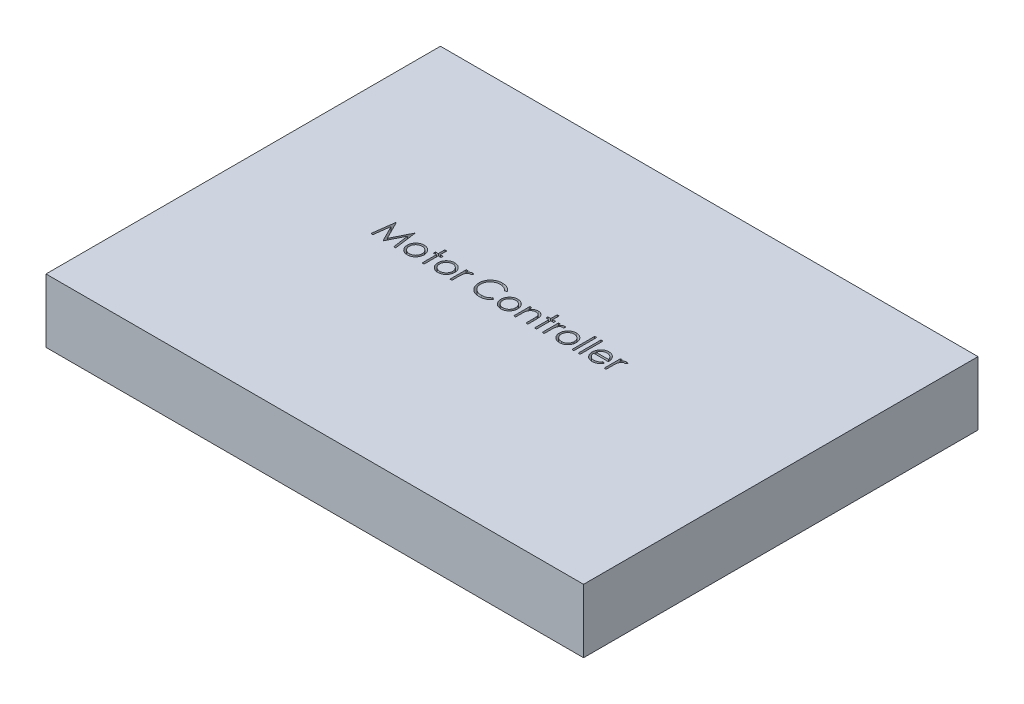
from build123d import *

# Parameters (mm, degrees)
SKETCH1_W           = 84.5
SKETCH1_H           = 62
BOSS_EXTRUDE1_DEPTH = 10
SKETCH2_W           = 0.314102564
SKETCH2_H           = 3.589743589
SKETCH2_W_2         = 0.314102565
CUT_EXTRUDE1_DEPTH  = 2.032


with BuildPart() as part:
    # Sketch1 → Boss-Extrude1 (new body)
    with BuildSketch(Plane(origin=(0, 0, 0), x_dir=(1, 0, 0), z_dir=(0, 1, 0))):
        Rectangle(SKETCH1_W, SKETCH1_H)
    extrude(amount=BOSS_EXTRUDE1_DEPTH)

    # Sketch2 → Cut-Extrude1 (cut)
    # profile 1 of 15: a face of its own
    with BuildSketch(Plane(origin=(0, 10, 0), x_dir=(1, 0, 0), z_dir=(0, 1, 0))):
        Polygon((-22.223237795, 0.043930603), (-21.761198533, 3.543930603), (-21.716326738, 3.543930603), (-20.271314719, 0.672135731), (-18.829808308, 3.543930603), (-18.784235392, 3.543930603), (-18.319391642, 0.043930603), (-18.634896449, 0.043930603), (-18.970032667, 2.56236009), (-20.233454142, 0.043930603), (-20.304267443, 0.043930603), (-21.57259677, 2.567969064), (-21.907031866, 0.043930603), align=None)
    # profile 2 of 15: a face of its own
    with BuildSketch(Plane(origin=(0, 10, 0), x_dir=(1, 0, 0), z_dir=(0, 1, 0))):
        with BuildLine():
            add(Edge.make_bspline(
                [(-16.455809911, 2.646494705), (-16.407818638, 2.645472814), (-16.31371948, 2.643469135), (-16.175911595, 2.62205417), (-16.044366459, 2.589306805), (-15.918580266, 2.544035243), (-15.800163971, 2.483353293), (-15.687392727, 2.410944002), (-15.580575718, 2.325161408), (-15.516552689, 2.25880334), (-15.484055103, 2.225120507)],
                knots=[0, 0, 0, 0, 1.054011418, 2.066658804, 3.057071809, 4.030435133, 4.997543892, 5.974964718, 6.972108034, 8, 8, 8, 8], degree=3))
            add(Edge.make_bspline(
                [(-15.484055103, 2.225120507), (-15.456073149, 2.192906521), (-15.400650769, 2.129101979), (-15.32958505, 2.025646366), (-15.26836349, 1.918506265), (-15.219300529, 1.806258938), (-15.180615505, 1.689884267), (-15.153149809, 1.568982256), (-15.136812874, 1.443819909), (-15.134609907, 1.358816071), (-15.133494206, 1.315765539)],
                knots=[0, 0, 0, 0, 1.025258237, 2.030674902, 3.01204498, 3.988269485, 4.97094183, 5.956517959, 6.965070386, 8, 8, 8, 8], degree=3))
            add(Edge.make_bspline(
                [(-15.133494206, 1.315765539), (-15.134475543, 1.272465481), (-15.136414711, 1.186902548), (-15.154758328, 1.060883182), (-15.183289414, 0.938688359), (-15.224121252, 0.820829665), (-15.276479361, 0.706946838), (-15.340370049, 0.597537289), (-15.416241666, 0.492385155), (-15.502245663, 0.392383317), (-15.597297539, 0.300217102), (-15.700413687, 0.219888833), (-15.809567721, 0.151067308), (-15.926211074, 0.095630893), (-16.049278561, 0.051921192), (-16.179035629, 0.021221176), (-16.315280699, 0.002659492), (-16.408307921, 0.000275919), (-16.455809911, -0.000941192)],
                knots=[0, 0, 0, 0, 0.998656419, 1.973391657, 2.932242238, 3.890759089, 4.846373663, 5.82037756, 6.809684879, 7.83454468, 8.860553229, 9.859544525, 10.845671541, 11.83227036, 12.833544569, 13.85385346, 14.904124723, 16, 16, 16, 16], degree=3))
            add(Edge.make_bspline(
                [(-16.455809911, -0.000941192), (-16.50354463, 0.000280004), (-16.59703549, 0.002671778), (-16.733761472, 0.021149061), (-16.863751091, 0.051907044), (-16.986979689, 0.095774537), (-17.104124536, 0.15106908), (-17.213911033, 0.21968077), (-17.317110949, 0.300240925), (-17.412182933, 0.392376862), (-17.498181539, 0.492386818), (-17.574054547, 0.597536857), (-17.637944873, 0.70694695), (-17.690303077, 0.820829635), (-17.73113489, 0.938688367), (-17.759665983, 1.06088318), (-17.778009597, 1.186902548), (-17.779948766, 1.272465481), (-17.780930103, 1.315765539)],
                knots=[0, 0, 0, 0, 1.099876186, 2.154163076, 3.173186993, 4.173200201, 5.163417411, 6.152872554, 7.150605724, 8.17532212, 9.198891216, 10.186952605, 11.159729845, 12.11414092, 13.071450619, 14.029093627, 15.002601286, 16, 16, 16, 16], degree=3))
            add(Edge.make_bspline(
                [(-17.780930103, 1.315765539), (-17.779806793, 1.358582084), (-17.777582831, 1.443351487), (-17.761262322, 1.568278548), (-17.733903766, 1.688975937), (-17.695172369, 1.804901413), (-17.645657178, 1.916656849), (-17.585295891, 2.02406168), (-17.513505258, 2.12704948), (-17.458303306, 2.19077156), (-17.430369206, 2.223017141)],
                knots=[0, 0, 0, 0, 1.031353054, 2.041901799, 3.029428768, 4.008703097, 4.981709435, 5.96992636, 6.972712378, 8, 8, 8, 8], degree=3))
            add(Edge.make_bspline(
                [(-17.430369206, 2.223017141), (-17.397920615, 2.25699208), (-17.334104751, 2.323809777), (-17.226756023, 2.409342301), (-17.114262202, 2.483258375), (-16.994537276, 2.54273459), (-16.868854418, 2.589573108), (-16.736635175, 2.622138623), (-16.59835966, 2.643391978), (-16.503800039, 2.645450156), (-16.455809911, 2.646494705)],
                knots=[0, 0, 0, 0, 1.027980169, 2.021703884, 2.998553061, 3.971491411, 4.943284454, 5.930300938, 6.949603206, 8, 8, 8, 8], degree=3))
        make_face()
        with BuildLine():
            add(Edge.make_bspline(
                [(-16.457212154, 2.332392141), (-16.491149766, 2.331427549), (-16.558148894, 2.329523267), (-16.656768479, 2.315039362), (-16.751708633, 2.292091858), (-16.843149477, 2.259487802), (-16.93078265, 2.217388903), (-17.014692052, 2.165680543), (-17.095124492, 2.105047586), (-17.170506555, 2.035584915), (-17.239688867, 1.95970592), (-17.300166844, 1.878857561), (-17.35159195, 1.794351215), (-17.394432109, 1.706099004), (-17.426339297, 1.61320659), (-17.44951232, 1.516725959), (-17.46398256, 1.416460542), (-17.465868939, 1.348299524), (-17.466827539, 1.313662173)],
                knots=[0, 0, 0, 0, 1.021534396, 2.016698045, 2.994645724, 3.958388632, 4.93408049, 5.916473867, 6.921342795, 7.962252576, 8.998418191, 10.008913653, 10.997312074, 11.973003931, 12.956656626, 13.948281152, 14.957379055, 16, 16, 16, 16], degree=3))
            add(Edge.make_bspline(
                [(-17.466827539, 1.313662173), (-17.465220715, 1.268910146), (-17.462031471, 1.180085741), (-17.436096235, 1.049274618), (-17.392709955, 0.923692766), (-17.334122675, 0.80407638), (-17.260716456, 0.693404102), (-17.17422939, 0.594732617), (-17.075589689, 0.509546806), (-16.965973189, 0.43886596), (-16.847618871, 0.382706205), (-16.72236255, 0.342907229), (-16.591721856, 0.317035536), (-16.502441125, 0.314464062), (-16.457212154, 0.313161372)],
                knots=[0, 0, 0, 0, 1.016792936, 2.018143844, 3.017858371, 4.030088057, 5.03801393, 6.028138512, 7.003788237, 7.991172063, 8.984598303, 9.972568034, 10.972917682, 12, 12, 12, 12], degree=3))
            add(Edge.make_bspline(
                [(-16.457212154, 0.313161372), (-16.411985786, 0.314471652), (-16.32271019, 0.317058109), (-16.192251013, 0.342776929), (-16.067337041, 0.382880589), (-15.949105653, 0.438802799), (-15.83953905, 0.509815214), (-15.740189929, 0.594251591), (-15.654441317, 0.693665443), (-15.581107713, 0.804222971), (-15.52156097, 0.923507323), (-15.478377768, 1.049297796), (-15.452380182, 1.180079838), (-15.449199353, 1.268908168), (-15.44759677, 1.313662173)],
                knots=[0, 0, 0, 0, 1.02726834, 2.027799167, 3.010890988, 4.004497153, 4.992059811, 5.971914811, 6.958719428, 7.966827853, 8.981595046, 9.981490638, 10.983022906, 12, 12, 12, 12], degree=3))
            add(Edge.make_bspline(
                [(-15.44759677, 1.313662173), (-15.44855504, 1.348299731), (-15.450440769, 1.416461157), (-15.464915733, 1.51672361), (-15.488071273, 1.613215207), (-15.52004289, 1.70606721), (-15.562696904, 1.794579714), (-15.615113697, 1.878609441), (-15.675344723, 1.959985987), (-15.745361843, 2.035339628), (-15.820665221, 2.105074665), (-15.90113026, 2.165704054), (-15.984915238, 2.21716165), (-16.072293821, 2.25984789), (-16.163746388, 2.291795231), (-16.258553518, 2.315171862), (-16.356752328, 2.329462059), (-16.423511371, 2.3314092), (-16.457212154, 2.332392141)],
                knots=[0, 0, 0, 0, 1.042956736, 2.052379634, 3.044323526, 4.02829302, 5.004299113, 5.996692471, 7.007513377, 8.048758398, 9.090003419, 10.095195979, 11.07790575, 12.047570684, 13.018257071, 13.989683339, 14.985167495, 16, 16, 16, 16], degree=3))
        make_face(mode=Mode.SUBTRACT)
    # profile 3 of 15: a face of its own
    with BuildSketch(Plane(origin=(0, 10, 0), x_dir=(1, 0, 0), z_dir=(0, 1, 0))):
        Polygon((-14.191186513, 3.633674192), (-13.877083949, 3.633674192), (-13.877083949, 2.60162291), (-13.428366001, 2.60162291), (-13.428366001, 2.287520346), (-13.877083949, 2.287520346), (-13.877083949, 0.043930603), (-14.191186513, 0.043930603), (-14.191186513, 2.287520346), (-14.639904462, 2.287520346), (-14.639904462, 2.60162291), (-14.191186513, 2.60162291), align=None)
    # profile 4 of 15: a face of its own
    with BuildSketch(Plane(origin=(0, 10, 0), x_dir=(1, 0, 0), z_dir=(0, 1, 0))):
        with BuildLine():
            add(Edge.make_bspline(
                [(-11.65452786, 2.646494705), (-11.606536587, 2.645472814), (-11.512437429, 2.643469135), (-11.374629543, 2.62205417), (-11.243084407, 2.589306805), (-11.117298215, 2.544035243), (-10.99888192, 2.483353293), (-10.886110676, 2.410944002), (-10.779293667, 2.325161408), (-10.715270637, 2.25880334), (-10.682773052, 2.225120507)],
                knots=[0, 0, 0, 0, 1.054011418, 2.066658804, 3.057071809, 4.030435133, 4.997543892, 5.974964718, 6.972108034, 8, 8, 8, 8], degree=3))
            add(Edge.make_bspline(
                [(-10.682773052, 2.225120507), (-10.654791098, 2.192906521), (-10.599368718, 2.129101979), (-10.528302999, 2.025646366), (-10.467081439, 1.918506265), (-10.418018478, 1.806258938), (-10.379333454, 1.689884267), (-10.351867758, 1.568982256), (-10.335530823, 1.443819909), (-10.333327856, 1.358816071), (-10.332212154, 1.315765539)],
                knots=[0, 0, 0, 0, 1.025258237, 2.030674902, 3.01204498, 3.988269485, 4.97094183, 5.956517959, 6.965070386, 8, 8, 8, 8], degree=3))
            add(Edge.make_bspline(
                [(-10.332212154, 1.315765539), (-10.333193492, 1.272465481), (-10.33513266, 1.186902548), (-10.353476276, 1.060883182), (-10.382007362, 0.938688359), (-10.422839201, 0.820829665), (-10.47519731, 0.706946838), (-10.539087997, 0.597537289), (-10.614959614, 0.492385155), (-10.700963611, 0.392383317), (-10.796015487, 0.300217102), (-10.899131636, 0.219888833), (-11.008285669, 0.151067308), (-11.124929023, 0.095630893), (-11.24799651, 0.051921192), (-11.377753578, 0.021221176), (-11.513998648, 0.002659492), (-11.607025869, 0.000275919), (-11.65452786, -0.000941192)],
                knots=[0, 0, 0, 0, 0.998656419, 1.973391657, 2.932242238, 3.890759089, 4.846373663, 5.82037756, 6.809684879, 7.83454468, 8.860553229, 9.859544525, 10.845671541, 11.83227036, 12.833544569, 13.85385346, 14.904124723, 16, 16, 16, 16], degree=3))
            add(Edge.make_bspline(
                [(-11.65452786, -0.000941192), (-11.702262579, 0.000280004), (-11.795753439, 0.002671778), (-11.932479421, 0.021149061), (-12.06246904, 0.051907044), (-12.185697638, 0.095774537), (-12.302842485, 0.15106908), (-12.412628982, 0.21968077), (-12.515828898, 0.300240925), (-12.610900882, 0.392376862), (-12.696899487, 0.492386818), (-12.772772496, 0.597536857), (-12.836662822, 0.70694695), (-12.889021026, 0.820829635), (-12.929852839, 0.938688367), (-12.958383931, 1.06088318), (-12.976727546, 1.186902548), (-12.978666714, 1.272465481), (-12.979648052, 1.315765539)],
                knots=[0, 0, 0, 0, 1.099876186, 2.154163076, 3.173186993, 4.173200201, 5.163417411, 6.152872554, 7.150605724, 8.17532212, 9.198891216, 10.186952605, 11.159729845, 12.11414092, 13.071450619, 14.029093627, 15.002601286, 16, 16, 16, 16], degree=3))
            add(Edge.make_bspline(
                [(-12.979648052, 1.315765539), (-12.978524742, 1.358582084), (-12.97630078, 1.443351487), (-12.959980271, 1.568278548), (-12.932621715, 1.688975937), (-12.893890318, 1.804901413), (-12.844375127, 1.916656849), (-12.784013839, 2.02406168), (-12.712223207, 2.12704948), (-12.657021255, 2.19077156), (-12.629087154, 2.223017141)],
                knots=[0, 0, 0, 0, 1.031353054, 2.041901799, 3.029428768, 4.008703097, 4.981709435, 5.96992636, 6.972712378, 8, 8, 8, 8], degree=3))
            add(Edge.make_bspline(
                [(-12.629087154, 2.223017141), (-12.596638563, 2.25699208), (-12.5328227, 2.323809777), (-12.425473972, 2.409342301), (-12.312980151, 2.483258375), (-12.193255225, 2.54273459), (-12.067572367, 2.589573108), (-11.935353124, 2.622138623), (-11.797077609, 2.643391978), (-11.702517988, 2.645450156), (-11.65452786, 2.646494705)],
                knots=[0, 0, 0, 0, 1.027980169, 2.021703884, 2.998553061, 3.971491411, 4.943284454, 5.930300938, 6.949603206, 8, 8, 8, 8], degree=3))
        make_face()
        with BuildLine():
            add(Edge.make_bspline(
                [(-11.655930103, 2.332392141), (-11.689867714, 2.331427549), (-11.756866843, 2.329523267), (-11.855486428, 2.315039362), (-11.950426582, 2.292091858), (-12.041867426, 2.259487802), (-12.129500598, 2.217388903), (-12.213410001, 2.165680543), (-12.293842441, 2.105047586), (-12.369224504, 2.035584915), (-12.438406816, 1.95970592), (-12.498884793, 1.878857561), (-12.550309899, 1.794351215), (-12.593150058, 1.706099004), (-12.625057246, 1.61320659), (-12.648230269, 1.516725959), (-12.662700509, 1.416460542), (-12.664586888, 1.348299524), (-12.665545488, 1.313662173)],
                knots=[0, 0, 0, 0, 1.021534396, 2.016698045, 2.994645724, 3.958388632, 4.93408049, 5.916473867, 6.921342795, 7.962252576, 8.998418191, 10.008913653, 10.997312074, 11.973003931, 12.956656626, 13.948281152, 14.957379055, 16, 16, 16, 16], degree=3))
            add(Edge.make_bspline(
                [(-12.665545488, 1.313662173), (-12.663938664, 1.268910146), (-12.66074942, 1.180085741), (-12.634814183, 1.049274618), (-12.591427903, 0.923692766), (-12.532840624, 0.80407638), (-12.459434405, 0.693404102), (-12.372947338, 0.594732617), (-12.274307638, 0.509546806), (-12.164691138, 0.43886596), (-12.04633682, 0.382706205), (-11.921080499, 0.342907229), (-11.790439805, 0.317035536), (-11.701159074, 0.314464062), (-11.655930103, 0.313161372)],
                knots=[0, 0, 0, 0, 1.016792936, 2.018143844, 3.017858371, 4.030088057, 5.03801393, 6.028138512, 7.003788237, 7.991172063, 8.984598303, 9.972568034, 10.972917682, 12, 12, 12, 12], degree=3))
            add(Edge.make_bspline(
                [(-11.655930103, 0.313161372), (-11.610703734, 0.314471652), (-11.521428138, 0.317058109), (-11.390968961, 0.342776929), (-11.26605499, 0.382880589), (-11.147823602, 0.438802799), (-11.038256999, 0.509815214), (-10.938907877, 0.594251591), (-10.853159266, 0.693665443), (-10.779825661, 0.804222971), (-10.720278919, 0.923507323), (-10.677095717, 1.049297796), (-10.651098131, 1.180079838), (-10.647917302, 1.268908168), (-10.646314719, 1.313662173)],
                knots=[0, 0, 0, 0, 1.02726834, 2.027799167, 3.010890988, 4.004497153, 4.992059811, 5.971914811, 6.958719428, 7.966827853, 8.981595046, 9.981490638, 10.983022906, 12, 12, 12, 12], degree=3))
            add(Edge.make_bspline(
                [(-10.646314719, 1.313662173), (-10.647272989, 1.348299731), (-10.649158718, 1.416461157), (-10.663633682, 1.51672361), (-10.686789222, 1.613215207), (-10.718760839, 1.70606721), (-10.761414853, 1.794579714), (-10.813831646, 1.878609441), (-10.874062671, 1.959985987), (-10.944079792, 2.035339628), (-11.01938317, 2.105074665), (-11.099848208, 2.165704054), (-11.183633187, 2.21716165), (-11.27101177, 2.25984789), (-11.362464337, 2.291795231), (-11.457271466, 2.315171862), (-11.555470276, 2.329462059), (-11.622229319, 2.3314092), (-11.655930103, 2.332392141)],
                knots=[0, 0, 0, 0, 1.042956736, 2.052379634, 3.044323526, 4.02829302, 5.004299113, 5.996692471, 7.007513377, 8.048758398, 9.090003419, 10.095195979, 11.07790575, 12.047570684, 13.018257071, 13.989683339, 14.985167495, 16, 16, 16, 16], degree=3))
        make_face(mode=Mode.SUBTRACT)
    # profile 5 of 15: a face of its own
    with BuildSketch(Plane(origin=(0, 10, 0), x_dir=(1, 0, 0), z_dir=(0, 1, 0))):
        with BuildLine():
            Line((-9.793750616, 2.60162291), (-9.479648052, 2.60162291))
            Line((-9.479648052, 2.60162291), (-9.479648052, 2.225120507))
            add(Edge.make_bspline(
                [(-9.479648052, 2.225120507), (-9.456459293, 2.260176335), (-9.412110972, 2.327220334), (-9.338398043, 2.415889635), (-9.262894712, 2.489304682), (-9.185239524, 2.547808201), (-9.104861424, 2.591621319), (-9.023524473, 2.623714354), (-8.939949003, 2.64269167), (-8.883787079, 2.645225329), (-8.855649654, 2.646494705)],
                knots=[0, 0, 0, 0, 1.2804753, 2.448899062, 3.506932113, 4.484331642, 5.4025378, 6.288909075, 7.142734305, 8, 8, 8, 8], degree=3))
            add(Edge.make_bspline(
                [(-8.855649654, 2.646494705), (-8.833823328, 2.645304179), (-8.788914243, 2.642854593), (-8.720931653, 2.625643768), (-8.650888201, 2.598165746), (-8.605745814, 2.572325523), (-8.582212154, 2.558854481)],
                knots=[0, 0, 0, 0, 0.901110191, 1.854092781, 2.881294221, 4, 4, 4, 4], degree=3))
            Line((-8.582212154, 2.558854481), (-8.754688116, 2.286819224))
            add(Edge.make_bspline(
                [(-8.754688116, 2.286819224), (-8.769797137, 2.293559491), (-8.798476952, 2.306353806), (-8.840431518, 2.321495816), (-8.879112855, 2.330411732), (-8.903756413, 2.331762449), (-8.915245007, 2.332392141)],
                knots=[0, 0, 0, 0, 1.180555205, 2.24091978, 3.179933427, 4, 4, 4, 4], degree=3))
            add(Edge.make_bspline(
                [(-8.915245007, 2.332392141), (-8.940450741, 2.330712104), (-8.99186313, 2.327285315), (-9.06734763, 2.300346507), (-9.140594835, 2.256821267), (-9.198766498, 2.208550155), (-9.243808751, 2.162002357), (-9.275948976, 2.121353955), (-9.305431723, 2.075775323), (-9.333601943, 2.026045639), (-9.359268238, 1.971315793), (-9.383222907, 1.91213258), (-9.40488177, 1.848427451), (-9.417232014, 1.804044931), (-9.423558308, 1.78131041)],
                knots=[0, 0, 0, 0, 1.125678352, 2.296057538, 3.5422874, 4.923748041, 5.663163013, 6.437101912, 7.23742474, 8.08941207, 8.991984279, 9.93940061, 10.944477711, 12, 12, 12, 12], degree=3))
            add(Edge.make_bspline(
                [(-9.423558308, 1.78131041), (-9.428290702, 1.761033237), (-9.438772593, 1.716120838), (-9.448964131, 1.640772313), (-9.459033649, 1.551748655), (-9.466130268, 1.448802062), (-9.47270831, 1.332189618), (-9.476418392, 1.201733672), (-9.479521532, 1.057300321), (-9.479604599, 0.956325968), (-9.479648052, 0.903505923)],
                knots=[0, 0, 0, 0, 0.566838948, 1.255505196, 2.06880316, 3.007127437, 4.065329342, 5.249902469, 6.561414163, 8, 8, 8, 8], degree=3))
            Line((-9.479648052, 0.903505923), (-9.479648052, 0.043930603))
            Line((-9.479648052, 0.043930603), (-9.793750616, 0.043930603))
            Line((-9.793750616, 0.043930603), (-9.793750616, 2.60162291))
        make_face()
    # profile 6 of 15: a face of its own
    with BuildSketch(Plane(origin=(0, 10, 0), x_dir=(1, 0, 0), z_dir=(0, 1, 0))):
        with BuildLine():
            Line((-3.601442924, 2.901703039), (-3.876282667, 2.6913665))
            add(Edge.make_bspline(
                [(-3.876282667, 2.6913665), (-3.895888556, 2.71473247), (-3.934836002, 2.761149386), (-3.997495205, 2.82632893), (-4.062796848, 2.887394192), (-4.130715969, 2.944636071), (-4.202475089, 2.996052837), (-4.276335887, 3.04432394), (-4.353533932, 3.087591678), (-4.460285667, 3.140054664), (-4.599933515, 3.194800819), (-4.775728354, 3.24070405), (-4.959239453, 3.269925226), (-5.084437053, 3.273090067), (-5.148117603, 3.274699833)],
                knots=[0, 0, 0, 0, 0.757959112, 1.505699292, 2.245454638, 2.979532153, 3.711538275, 4.438200793, 5.171680507, 5.909471876, 7.393775596, 8.890124382, 10.418191784, 12, 12, 12, 12], degree=3))
            add(Edge.make_bspline(
                [(-5.148117603, 3.274699833), (-5.183200902, 3.274295871), (-5.253041895, 3.273491695), (-5.356690369, 3.26288257), (-5.45840342, 3.24797136), (-5.558114886, 3.225846037), (-5.655697844, 3.197873418), (-5.751790247, 3.164448004), (-5.845000846, 3.123093164), (-5.936619085, 3.077384904), (-6.024398296, 3.025757459), (-6.107453343, 2.969444107), (-6.185481311, 2.909075011), (-6.258543923, 2.844423904), (-6.326715872, 2.775781944), (-6.389503183, 2.702417602), (-6.446688593, 2.624565429), (-6.499405618, 2.543252021), (-6.546618351, 2.45871423), (-6.586148231, 2.370639159), (-6.621153353, 2.280535056), (-6.648852595, 2.187383895), (-6.670777112, 2.091841129), (-6.685904776, 1.993650341), (-6.696393247, 1.893016662), (-6.697193424, 1.824807349), (-6.69759677, 1.790424994)],
                knots=[0, 0, 0, 0, 1.054917814, 2.100044995, 3.131103042, 4.146048494, 5.169673617, 6.183595914, 7.203665975, 8.234915748, 9.262203917, 10.264457458, 11.251630812, 12.227803204, 13.197192746, 14.159520551, 15.12972552, 16.100847026, 17.073214652, 18.039054194, 19.002613845, 19.979014051, 20.95965708, 21.949030935, 22.966165397, 24, 24, 24, 24], degree=3))
            add(Edge.make_bspline(
                [(-6.69759677, 1.790424994), (-6.696334951, 1.738693674), (-6.693857537, 1.637126089), (-6.671809202, 1.488355478), (-6.638304111, 1.345834805), (-6.588088534, 1.210454962), (-6.526169484, 1.080546604), (-6.447928872, 0.958307751), (-6.357312335, 0.841891186), (-6.253037915, 0.734048239), (-6.138632099, 0.635534513), (-6.015884188, 0.548783932), (-5.8850999, 0.476469049), (-5.74772327, 0.416293103), (-5.602697156, 0.370036375), (-5.450282353, 0.337472252), (-5.290810358, 0.316230071), (-5.181840958, 0.314196383), (-5.126382828, 0.313161372)],
                knots=[0, 0, 0, 0, 1.029171465, 2.020641659, 2.987623507, 3.938342917, 4.889210282, 5.84687017, 6.821220943, 7.821438502, 8.827599549, 9.822697543, 10.807740252, 11.797342354, 12.80366471, 13.83203677, 14.896651826, 16, 16, 16, 16], degree=3))
            add(Edge.make_bspline(
                [(-5.126382828, 0.313161372), (-5.065280139, 0.314850152), (-4.94501543, 0.318174074), (-4.768647403, 0.346333323), (-4.599811638, 0.391991241), (-4.438499051, 0.455889163), (-4.285164405, 0.538954451), (-4.139567745, 0.639652329), (-4.001586174, 0.758940662), (-3.918614892, 0.85002379), (-3.876282667, 0.896494705)],
                knots=[0, 0, 0, 0, 1.028121516, 2.023589091, 2.998037872, 3.967518031, 4.937445131, 5.927275754, 6.942489185, 8, 8, 8, 8], degree=3))
            Line((-3.876282667, 0.896494705), (-3.601442924, 0.688261532))
            add(Edge.make_bspline(
                [(-3.601442924, 0.688261532), (-3.623561034, 0.65972308), (-3.667691309, 0.602782874), (-3.739149326, 0.522511164), (-3.814426623, 0.447007129), (-3.894082333, 0.376879508), (-3.977200125, 0.310725042), (-4.065272437, 0.250423211), (-4.15714147, 0.195132326), (-4.252495949, 0.144505402), (-4.351234561, 0.099588155), (-4.453238996, 0.061134387), (-4.558069572, 0.028009497), (-4.66573108, 0.000757561), (-4.776446837, -0.020513523), (-4.889817311, -0.034733198), (-5.006087186, -0.044475112), (-5.084528607, -0.045363028), (-5.124279462, -0.045812987)],
                knots=[0, 0, 0, 0, 0.986787822, 1.968848986, 2.935600012, 3.899624008, 4.868462664, 5.837806735, 6.815139263, 7.798259679, 8.787526145, 9.778297419, 10.776456485, 11.791383307, 12.812564526, 13.85620153, 14.913611965, 16, 16, 16, 16], degree=3))
            add(Edge.make_bspline(
                [(-5.124279462, -0.045812987), (-5.161923129, -0.045550995), (-5.236358819, -0.045032937), (-5.346257571, -0.036640769), (-5.453247152, -0.025191032), (-5.557021778, -0.007950901), (-5.658147753, 0.012393439), (-5.755708337, 0.039664695), (-5.850663547, 0.070213862), (-5.942631888, 0.106118849), (-6.031691588, 0.146635031), (-6.117555399, 0.19242659), (-6.200183832, 0.243108455), (-6.280389253, 0.297563465), (-6.356986836, 0.357540767), (-6.430640362, 0.422207402), (-6.501762838, 0.491345412), (-6.545765523, 0.541200266), (-6.567889238, 0.56626634)],
                knots=[0, 0, 0, 0, 1.114604814, 2.203992996, 3.262667896, 4.300477797, 5.318619304, 6.316056647, 7.298880507, 8.271930387, 9.238335007, 10.195173496, 11.151986948, 12.108099108, 13.064862484, 14.031167946, 15.010108607, 16, 16, 16, 16], degree=3))
            add(Edge.make_bspline(
                [(-6.567889238, 0.56626634), (-6.603324881, 0.609807529), (-6.673768358, 0.696364239), (-6.763894042, 0.83665022), (-6.841041597, 0.983118429), (-6.903417518, 1.136538358), (-6.952180251, 1.296565745), (-6.985961446, 1.46328126), (-7.00791305, 1.636529202), (-7.010423339, 1.754365991), (-7.011699334, 1.814263135)],
                knots=[0, 0, 0, 0, 0.994628077, 1.977248131, 2.950237994, 3.925870899, 4.908910175, 5.911660606, 6.938484602, 8, 8, 8, 8], degree=3))
            add(Edge.make_bspline(
                [(-7.011699334, 1.814263135), (-7.01014414, 1.877218588), (-7.007084394, 2.001079513), (-6.981088599, 2.182853466), (-6.939269802, 2.357004865), (-6.879872914, 2.52320861), (-6.804567563, 2.68233889), (-6.711540949, 2.833180095), (-6.601873807, 2.976696894), (-6.476426239, 3.110711646), (-6.338858904, 3.233250998), (-6.19154009, 3.341057202), (-6.034758143, 3.430774718), (-5.870240291, 3.50577088), (-5.696754609, 3.563415344), (-5.51467124, 3.60376853), (-5.324332326, 3.628885646), (-5.1944699, 3.632060854), (-5.128486193, 3.633674192)],
                knots=[0, 0, 0, 0, 1.032925535, 2.032216505, 3.007276963, 3.968222605, 4.92396291, 5.891752235, 6.871517503, 7.883894988, 8.900124299, 9.891468569, 10.874487609, 11.85992873, 12.854644235, 13.869047385, 14.917252991, 16, 16, 16, 16], degree=3))
            add(Edge.make_bspline(
                [(-5.128486193, 3.633674192), (-5.088271721, 3.633192054), (-5.008671224, 3.63223771), (-4.890918571, 3.622931568), (-4.776276244, 3.607417962), (-4.664665262, 3.586301892), (-4.555542646, 3.560094571), (-4.449742405, 3.525954272), (-4.346643718, 3.486917741), (-4.24689681, 3.441959275), (-4.15098026, 3.391492534), (-4.058923941, 3.33607691), (-3.971459083, 3.275781105), (-3.887970234, 3.211117929), (-3.809854023, 3.14071937), (-3.734892545, 3.066521774), (-3.665631467, 2.98638795), (-3.622878272, 2.929983016), (-3.601442924, 2.901703039)],
                knots=[0, 0, 0, 0, 1.096760587, 2.17092713, 3.219439832, 4.250915756, 5.268269357, 6.278326846, 7.281116186, 8.274029601, 9.260640565, 10.235837813, 11.203064059, 12.156899882, 13.114053108, 14.069676657, 15.032185724, 16, 16, 16, 16], degree=3))
        make_face()
    # profile 7 of 15: a face of its own
    with BuildSketch(Plane(origin=(0, 10, 0), x_dir=(1, 0, 0), z_dir=(0, 1, 0))):
        with BuildLine():
            add(Edge.make_bspline(
                [(-1.737861193, 2.646494705), (-1.68986992, 2.645472814), (-1.595770762, 2.643469135), (-1.457962877, 2.62205417), (-1.326417741, 2.589306805), (-1.200631549, 2.544035243), (-1.082215253, 2.483353293), (-0.969444009, 2.410944002), (-0.862627, 2.325161408), (-0.798603971, 2.25880334), (-0.766106385, 2.225120507)],
                knots=[0, 0, 0, 0, 1.054011418, 2.066658804, 3.057071809, 4.030435133, 4.997543892, 5.974964718, 6.972108034, 8, 8, 8, 8], degree=3))
            add(Edge.make_bspline(
                [(-0.766106385, 2.225120507), (-0.738124431, 2.192906521), (-0.682702051, 2.129101979), (-0.611636332, 2.025646366), (-0.550414772, 1.918506265), (-0.501351811, 1.806258938), (-0.462666787, 1.689884267), (-0.435201091, 1.568982256), (-0.418864156, 1.443819909), (-0.416661189, 1.358816071), (-0.415545488, 1.315765539)],
                knots=[0, 0, 0, 0, 1.025258237, 2.030674902, 3.01204498, 3.988269485, 4.97094183, 5.956517959, 6.965070386, 8, 8, 8, 8], degree=3))
            add(Edge.make_bspline(
                [(-0.415545488, 1.315765539), (-0.416526825, 1.272465481), (-0.418465993, 1.186902548), (-0.43680961, 1.060883182), (-0.465340696, 0.938688359), (-0.506172534, 0.820829665), (-0.558530643, 0.706946838), (-0.622421331, 0.597537289), (-0.698292948, 0.492385155), (-0.784296945, 0.392383317), (-0.879348821, 0.300217102), (-0.982464969, 0.219888833), (-1.091619003, 0.151067308), (-1.208262356, 0.095630893), (-1.331329843, 0.051921192), (-1.461086911, 0.021221176), (-1.597331981, 0.002659492), (-1.690359203, 0.000275919), (-1.737861193, -0.000941192)],
                knots=[0, 0, 0, 0, 0.998656419, 1.973391657, 2.932242238, 3.890759089, 4.846373663, 5.82037756, 6.809684879, 7.83454468, 8.860553229, 9.859544525, 10.845671541, 11.83227036, 12.833544569, 13.85385346, 14.904124723, 16, 16, 16, 16], degree=3))
            add(Edge.make_bspline(
                [(-1.737861193, -0.000941192), (-1.785595912, 0.000280004), (-1.879086772, 0.002671778), (-2.015812754, 0.021149061), (-2.145802373, 0.051907044), (-2.269030972, 0.095774537), (-2.386175818, 0.15106908), (-2.495962315, 0.21968077), (-2.599162231, 0.300240925), (-2.694234215, 0.392376862), (-2.780232821, 0.492386818), (-2.856105829, 0.597536857), (-2.919996155, 0.70694695), (-2.972354359, 0.820829635), (-3.013186172, 0.938688367), (-3.041717265, 1.06088318), (-3.060060879, 1.186902548), (-3.062000048, 1.272465481), (-3.062981385, 1.315765539)],
                knots=[0, 0, 0, 0, 1.099876186, 2.154163076, 3.173186993, 4.173200201, 5.163417411, 6.152872554, 7.150605724, 8.17532212, 9.198891216, 10.186952605, 11.159729845, 12.11414092, 13.071450619, 14.029093627, 15.002601286, 16, 16, 16, 16], degree=3))
            add(Edge.make_bspline(
                [(-3.062981385, 1.315765539), (-3.061858075, 1.358582084), (-3.059634113, 1.443351487), (-3.043313604, 1.568278548), (-3.015955048, 1.688975937), (-2.977223651, 1.804901413), (-2.927708461, 1.916656849), (-2.867347173, 2.02406168), (-2.79555654, 2.12704948), (-2.740354588, 2.19077156), (-2.712420488, 2.223017141)],
                knots=[0, 0, 0, 0, 1.031353054, 2.041901799, 3.029428768, 4.008703097, 4.981709435, 5.96992636, 6.972712378, 8, 8, 8, 8], degree=3))
            add(Edge.make_bspline(
                [(-2.712420488, 2.223017141), (-2.679971897, 2.25699208), (-2.616156033, 2.323809777), (-2.508807305, 2.409342301), (-2.396313484, 2.483258375), (-2.276588558, 2.54273459), (-2.1509057, 2.589573108), (-2.018686457, 2.622138623), (-1.880410942, 2.643391978), (-1.785851321, 2.645450156), (-1.737861193, 2.646494705)],
                knots=[0, 0, 0, 0, 1.027980169, 2.021703884, 2.998553061, 3.971491411, 4.943284454, 5.930300938, 6.949603206, 8, 8, 8, 8], degree=3))
        make_face()
        with BuildLine():
            add(Edge.make_bspline(
                [(-1.739263436, 2.332392141), (-1.773201048, 2.331427549), (-1.840200176, 2.329523267), (-1.938819761, 2.315039362), (-2.033759915, 2.292091858), (-2.125200759, 2.259487802), (-2.212833932, 2.217388903), (-2.296743334, 2.165680543), (-2.377175774, 2.105047586), (-2.452557837, 2.035584915), (-2.52174015, 1.95970592), (-2.582218126, 1.878857561), (-2.633643232, 1.794351215), (-2.676483391, 1.706099004), (-2.70839058, 1.61320659), (-2.731563602, 1.516725959), (-2.746033842, 1.416460542), (-2.747920221, 1.348299524), (-2.748878821, 1.313662173)],
                knots=[0, 0, 0, 0, 1.021534396, 2.016698045, 2.994645724, 3.958388632, 4.93408049, 5.916473867, 6.921342795, 7.962252576, 8.998418191, 10.008913653, 10.997312074, 11.973003931, 12.956656626, 13.948281152, 14.957379055, 16, 16, 16, 16], degree=3))
            add(Edge.make_bspline(
                [(-2.748878821, 1.313662173), (-2.747271997, 1.268910146), (-2.744082753, 1.180085741), (-2.718147517, 1.049274618), (-2.674761237, 0.923692766), (-2.616173957, 0.80407638), (-2.542767738, 0.693404102), (-2.456280672, 0.594732617), (-2.357640971, 0.509546806), (-2.248024471, 0.43886596), (-2.129670153, 0.382706205), (-2.004413832, 0.342907229), (-1.873773138, 0.317035536), (-1.784492407, 0.314464062), (-1.739263436, 0.313161372)],
                knots=[0, 0, 0, 0, 1.016792936, 2.018143844, 3.017858371, 4.030088057, 5.03801393, 6.028138512, 7.003788237, 7.991172063, 8.984598303, 9.972568034, 10.972917682, 12, 12, 12, 12], degree=3))
            add(Edge.make_bspline(
                [(-1.739263436, 0.313161372), (-1.694037068, 0.314471652), (-1.604761472, 0.317058109), (-1.474302295, 0.342776929), (-1.349388323, 0.382880589), (-1.231156935, 0.438802799), (-1.121590332, 0.509815214), (-1.022241211, 0.594251591), (-0.936492599, 0.693665443), (-0.863158995, 0.804222971), (-0.803612252, 0.923507323), (-0.76042905, 1.049297796), (-0.734431464, 1.180079838), (-0.731250635, 1.268908168), (-0.729648052, 1.313662173)],
                knots=[0, 0, 0, 0, 1.02726834, 2.027799167, 3.010890988, 4.004497153, 4.992059811, 5.971914811, 6.958719428, 7.966827853, 8.981595046, 9.981490638, 10.983022906, 12, 12, 12, 12], degree=3))
            add(Edge.make_bspline(
                [(-0.729648052, 1.313662173), (-0.730606322, 1.348299731), (-0.732492051, 1.416461157), (-0.746967015, 1.51672361), (-0.770122555, 1.613215207), (-0.802094172, 1.70606721), (-0.844748186, 1.794579714), (-0.897164979, 1.878609441), (-0.957396005, 1.959985987), (-1.027413126, 2.035339628), (-1.102716503, 2.105074665), (-1.183181542, 2.165704054), (-1.26696652, 2.21716165), (-1.354345103, 2.25984789), (-1.445797671, 2.291795231), (-1.5406048, 2.315171862), (-1.63880361, 2.329462059), (-1.705562653, 2.3314092), (-1.739263436, 2.332392141)],
                knots=[0, 0, 0, 0, 1.042956736, 2.052379634, 3.044323526, 4.02829302, 5.004299113, 5.996692471, 7.007513377, 8.048758398, 9.090003419, 10.095195979, 11.07790575, 12.047570684, 13.018257071, 13.989683339, 14.985167495, 16, 16, 16, 16], degree=3))
        make_face(mode=Mode.SUBTRACT)
    # profile 8 of 15: a face of its own
    with BuildSketch(Plane(origin=(0, 10, 0), x_dir=(1, 0, 0), z_dir=(0, 1, 0))):
        with BuildLine():
            Line((0.21265964, 2.60162291), (0.526762205, 2.60162291))
            Line((0.526762205, 2.60162291), (0.526762205, 2.140284769))
            add(Edge.make_bspline(
                [(0.526762205, 2.140284769), (0.56029984, 2.182127492), (0.625380791, 2.263324756), (0.733765124, 2.37004533), (0.848309024, 2.457990555), (0.968311028, 2.528094349), (1.093934038, 2.580940975), (1.224412308, 2.619106906), (1.360527014, 2.641991735), (1.453091451, 2.644981965), (1.499919256, 2.646494705)],
                knots=[0, 0, 0, 0, 1.12780773, 2.188550248, 3.19190651, 4.159438251, 5.104880172, 6.052711206, 7.014878035, 8, 8, 8, 8], degree=3))
            add(Edge.make_bspline(
                [(1.499919256, 2.646494705), (1.54724989, 2.64474951), (1.639887358, 2.641333741), (1.774765419, 2.61431705), (1.900738813, 2.568171795), (2.017358369, 2.504959725), (2.122485582, 2.426353251), (2.214810433, 2.33477547), (2.291173681, 2.229439386), (2.342371044, 2.13171623), (2.376096691, 2.045027436), (2.397329029, 1.970780686), (2.41536001, 1.888062535), (2.430991758, 1.797122945), (2.44156887, 1.697324755), (2.449911162, 1.589077063), (2.455889856, 1.472414933), (2.456127063, 1.391728305), (2.456249384, 1.350120507)],
                knots=[0, 0, 0, 0, 1.235846778, 2.418850247, 3.575807741, 4.728682307, 5.871620074, 6.994088408, 8.11269785, 9.256955736, 9.865816715, 10.540099792, 11.271859618, 12.076849838, 12.949306005, 13.892391288, 14.913166135, 16, 16, 16, 16], degree=3))
            Line((2.456249384, 1.350120507), (2.456249384, 0.043930603))
            Line((2.456249384, 0.043930603), (2.14214682, 0.043930603))
            Line((2.14214682, 0.043930603), (2.14214682, 1.247055603))
            add(Edge.make_bspline(
                [(2.14214682, 1.247055603), (2.141953612, 1.281878048), (2.141584038, 1.348487458), (2.140418391, 1.443856482), (2.137608585, 1.53034306), (2.133660272, 1.607740427), (2.127881241, 1.675974264), (2.12185861, 1.735183541), (2.114493633, 1.785293083), (2.10793072, 1.815458165), (2.104987365, 1.828986692)],
                knots=[0, 0, 0, 0, 1.430800155, 2.736877192, 3.918605307, 4.986035426, 5.920637409, 6.731861385, 7.431261377, 8, 8, 8, 8], degree=3))
            add(Edge.make_bspline(
                [(2.104987365, 1.828986692), (2.094361833, 1.868697877), (2.073910973, 1.945129622), (2.023376989, 2.048803975), (1.959562809, 2.137002162), (1.881664959, 2.209178884), (1.790435884, 2.265349721), (1.686128741, 2.304323675), (1.5697501, 2.328699945), (1.487895718, 2.331127077), (1.445231756, 2.332392141)],
                knots=[0, 0, 0, 0, 1.084156227, 2.086665306, 3.027808233, 3.945421172, 4.874247719, 5.839848303, 6.874090471, 8, 8, 8, 8], degree=3))
            add(Edge.make_bspline(
                [(1.445231756, 2.332392141), (1.419964072, 2.331916136), (1.369959979, 2.330974136), (1.295810007, 2.321522838), (1.223885834, 2.306064382), (1.153465625, 2.285195744), (1.085957831, 2.256533475), (1.01919354, 2.224004105), (0.955686776, 2.183455893), (0.894083379, 2.138265272), (0.836770571, 2.088186064), (0.783442233, 2.035341554), (0.735904213, 1.97906595), (0.692835537, 1.920266003), (0.655657274, 1.858134165), (0.623204186, 1.793269858), (0.595668491, 1.72558771), (0.581985799, 1.678612648), (0.575139608, 1.655108487)],
                knots=[0, 0, 0, 0, 1.023777757, 2.026029729, 3.023749952, 4.003683103, 4.997618607, 5.993177895, 7.010360494, 8.046726602, 9.087585522, 10.09234134, 11.086953743, 12.070360549, 13.043493632, 14.017870808, 15.008233677, 16, 16, 16, 16], degree=3))
            add(Edge.make_bspline(
                [(0.575139608, 1.655108487), (0.57119996, 1.637853284), (0.562623551, 1.60028961), (0.553360371, 1.53864519), (0.544952796, 1.467335215), (0.537915837, 1.386442898), (0.533610421, 1.295685023), (0.528916024, 1.195449185), (0.527206963, 1.085335697), (0.526914609, 1.008674004), (0.526762205, 0.96871025)],
                knots=[0, 0, 0, 0, 0.615963638, 1.340920617, 2.168419149, 3.115676021, 4.16674242, 5.331190069, 6.6087489, 8, 8, 8, 8], degree=3))
            Line((0.526762205, 0.96871025), (0.526762205, 0.043930603))
            Line((0.526762205, 0.043930603), (0.21265964, 0.043930603))
            Line((0.21265964, 0.043930603), (0.21265964, 2.60162291))
        make_face()
    # profile 9 of 15: a face of its own
    with BuildSketch(Plane(origin=(0, 10, 0), x_dir=(1, 0, 0), z_dir=(0, 1, 0))):
        Polygon((3.488300666, 3.633674192), (3.80240323, 3.633674192), (3.80240323, 2.60162291), (4.251121179, 2.60162291), (4.251121179, 2.287520346), (3.80240323, 2.287520346), (3.80240323, 0.043930603), (3.488300666, 0.043930603), (3.488300666, 2.287520346), (3.039582717, 2.287520346), (3.039582717, 2.60162291), (3.488300666, 2.60162291), align=None)
    # profile 10 of 15: a face of its own
    with BuildSketch(Plane(origin=(0, 10, 0), x_dir=(1, 0, 0), z_dir=(0, 1, 0))):
        with BuildLine():
            Line((4.699839128, 2.60162291), (5.013941692, 2.60162291))
            Line((5.013941692, 2.60162291), (5.013941692, 2.225120507))
            add(Edge.make_bspline(
                [(5.013941692, 2.225120507), (5.03713045, 2.260176335), (5.081478771, 2.327220334), (5.155191701, 2.415889635), (5.230695032, 2.489304682), (5.308350219, 2.547808201), (5.388728319, 2.591621319), (5.470065271, 2.623714354), (5.553640741, 2.64269167), (5.609802665, 2.645225329), (5.637940089, 2.646494705)],
                knots=[0, 0, 0, 0, 1.2804753, 2.448899062, 3.506932113, 4.484331642, 5.4025378, 6.288909075, 7.142734305, 8, 8, 8, 8], degree=3))
            add(Edge.make_bspline(
                [(5.637940089, 2.646494705), (5.659766416, 2.645304179), (5.704675501, 2.642854593), (5.772658091, 2.625643768), (5.842701543, 2.598165746), (5.88784393, 2.572325523), (5.911377589, 2.558854481)],
                knots=[0, 0, 0, 0, 0.901110191, 1.854092781, 2.881294221, 4, 4, 4, 4], degree=3))
            Line((5.911377589, 2.558854481), (5.738901628, 2.286819224))
            add(Edge.make_bspline(
                [(5.738901628, 2.286819224), (5.723792606, 2.293559491), (5.695112792, 2.306353806), (5.653158226, 2.321495816), (5.614476889, 2.330411732), (5.589833331, 2.331762449), (5.578344737, 2.332392141)],
                knots=[0, 0, 0, 0, 1.180555205, 2.24091978, 3.179933427, 4, 4, 4, 4], degree=3))
            add(Edge.make_bspline(
                [(5.578344737, 2.332392141), (5.553139003, 2.330712104), (5.501726613, 2.327285315), (5.426242114, 2.300346507), (5.352994908, 2.256821267), (5.294823246, 2.208550155), (5.249780993, 2.162002357), (5.217640767, 2.121353955), (5.188158021, 2.075775323), (5.1599878, 2.026045639), (5.134321506, 1.971315793), (5.110366837, 1.91213258), (5.088707974, 1.848427451), (5.07635773, 1.804044931), (5.070031435, 1.78131041)],
                knots=[0, 0, 0, 0, 1.125678352, 2.296057538, 3.5422874, 4.923748041, 5.663163013, 6.437101912, 7.23742474, 8.08941207, 8.991984279, 9.93940061, 10.944477711, 12, 12, 12, 12], degree=3))
            add(Edge.make_bspline(
                [(5.070031435, 1.78131041), (5.065299042, 1.761033237), (5.05481715, 1.716120838), (5.044625612, 1.640772313), (5.034556094, 1.551748655), (5.027459476, 1.448802062), (5.020881434, 1.332189618), (5.017171352, 1.201733672), (5.014068211, 1.057300321), (5.013985144, 0.956325968), (5.013941692, 0.903505923)],
                knots=[0, 0, 0, 0, 0.566838948, 1.255505196, 2.06880316, 3.007127437, 4.065329342, 5.249902469, 6.561414163, 8, 8, 8, 8], degree=3))
            Line((5.013941692, 0.903505923), (5.013941692, 0.043930603))
            Line((5.013941692, 0.043930603), (4.699839128, 0.043930603))
            Line((4.699839128, 0.043930603), (4.699839128, 2.60162291))
        make_face()
    # profile 11 of 15: a face of its own
    with BuildSketch(Plane(origin=(0, 10, 0), x_dir=(1, 0, 0), z_dir=(0, 1, 0))):
        with BuildLine():
            add(Edge.make_bspline(
                [(7.460856756, 2.646494705), (7.508848029, 2.645472814), (7.602947186, 2.643469135), (7.740755072, 2.62205417), (7.872300208, 2.589306805), (7.9980864, 2.544035243), (8.116502696, 2.483353293), (8.22927394, 2.410944002), (8.336090949, 2.325161408), (8.400113978, 2.25880334), (8.432611564, 2.225120507)],
                knots=[0, 0, 0, 0, 1.054011418, 2.066658804, 3.057071809, 4.030435133, 4.997543892, 5.974964718, 6.972108034, 8, 8, 8, 8], degree=3))
            add(Edge.make_bspline(
                [(8.432611564, 2.225120507), (8.460593518, 2.192906521), (8.516015898, 2.129101979), (8.587081617, 2.025646366), (8.648303177, 1.918506265), (8.697366138, 1.806258938), (8.736051161, 1.689884267), (8.763516858, 1.568982256), (8.779853793, 1.443819909), (8.78205676, 1.358816071), (8.783172461, 1.315765539)],
                knots=[0, 0, 0, 0, 1.025258237, 2.030674902, 3.01204498, 3.988269485, 4.97094183, 5.956517959, 6.965070386, 8, 8, 8, 8], degree=3))
            add(Edge.make_bspline(
                [(8.783172461, 1.315765539), (8.782191124, 1.272465481), (8.780251955, 1.186902548), (8.761908339, 1.060883182), (8.733377253, 0.938688359), (8.692545415, 0.820829665), (8.640187306, 0.706946838), (8.576296618, 0.597537289), (8.500425001, 0.492385155), (8.414421004, 0.392383317), (8.319369128, 0.300217102), (8.21625298, 0.219888833), (8.107098946, 0.151067308), (7.990455593, 0.095630893), (7.867388106, 0.051921192), (7.737631038, 0.021221176), (7.601385967, 0.002659492), (7.508358746, 0.000275919), (7.460856756, -0.000941192)],
                knots=[0, 0, 0, 0, 0.998656419, 1.973391657, 2.932242238, 3.890759089, 4.846373663, 5.82037756, 6.809684879, 7.83454468, 8.860553229, 9.859544525, 10.845671541, 11.83227036, 12.833544569, 13.85385346, 14.904124723, 16, 16, 16, 16], degree=3))
            add(Edge.make_bspline(
                [(7.460856756, -0.000941192), (7.413122036, 0.000280004), (7.319631177, 0.002671778), (7.182905195, 0.021149061), (7.052915576, 0.051907044), (6.929686977, 0.095774537), (6.81254213, 0.15106908), (6.702755633, 0.21968077), (6.599555718, 0.300240925), (6.504483733, 0.392376862), (6.418485128, 0.492386818), (6.34261212, 0.597536857), (6.278721794, 0.70694695), (6.22636359, 0.820829635), (6.185531777, 0.938688367), (6.157000684, 1.06088318), (6.13865707, 1.186902548), (6.136717901, 1.272465481), (6.135736564, 1.315765539)],
                knots=[0, 0, 0, 0, 1.099876186, 2.154163076, 3.173186993, 4.173200201, 5.163417411, 6.152872554, 7.150605724, 8.17532212, 9.198891216, 10.186952605, 11.159729845, 12.11414092, 13.071450619, 14.029093627, 15.002601286, 16, 16, 16, 16], degree=3))
            add(Edge.make_bspline(
                [(6.135736564, 1.315765539), (6.136859874, 1.358582084), (6.139083835, 1.443351487), (6.155404344, 1.568278548), (6.182762901, 1.688975937), (6.221494297, 1.804901413), (6.271009488, 1.916656849), (6.331370776, 2.02406168), (6.403161409, 2.12704948), (6.45836336, 2.19077156), (6.486297461, 2.223017141)],
                knots=[0, 0, 0, 0, 1.031353054, 2.041901799, 3.029428768, 4.008703097, 4.981709435, 5.96992636, 6.972712378, 8, 8, 8, 8], degree=3))
            add(Edge.make_bspline(
                [(6.486297461, 2.223017141), (6.518746052, 2.25699208), (6.582561916, 2.323809777), (6.689910644, 2.409342301), (6.802404465, 2.483258375), (6.922129391, 2.54273459), (7.047812249, 2.589573108), (7.180031491, 2.622138623), (7.318307007, 2.643391978), (7.412866628, 2.645450156), (7.460856756, 2.646494705)],
                knots=[0, 0, 0, 0, 1.027980169, 2.021703884, 2.998553061, 3.971491411, 4.943284454, 5.930300938, 6.949603206, 8, 8, 8, 8], degree=3))
        make_face()
        with BuildLine():
            add(Edge.make_bspline(
                [(7.459454512, 2.332392141), (7.425516901, 2.331427549), (7.358517772, 2.329523267), (7.259898188, 2.315039362), (7.164958034, 2.292091858), (7.073517189, 2.259487802), (6.985884017, 2.217388903), (6.901974615, 2.165680543), (6.821542175, 2.105047586), (6.746160111, 2.035584915), (6.676977799, 1.95970592), (6.616499823, 1.878857561), (6.565074716, 1.794351215), (6.522234557, 1.706099004), (6.490327369, 1.61320659), (6.467154347, 1.516725959), (6.452684106, 1.416460542), (6.450797728, 1.348299524), (6.449839128, 1.313662173)],
                knots=[0, 0, 0, 0, 1.021534396, 2.016698045, 2.994645724, 3.958388632, 4.93408049, 5.916473867, 6.921342795, 7.962252576, 8.998418191, 10.008913653, 10.997312074, 11.973003931, 12.956656626, 13.948281152, 14.957379055, 16, 16, 16, 16], degree=3))
            add(Edge.make_bspline(
                [(6.449839128, 1.313662173), (6.451445951, 1.268910146), (6.454635196, 1.180085741), (6.480570432, 1.049274618), (6.523956712, 0.923692766), (6.582543992, 0.80407638), (6.65595021, 0.693404102), (6.742437277, 0.594732617), (6.841076977, 0.509546806), (6.950693478, 0.43886596), (7.069047796, 0.382706205), (7.194304117, 0.342907229), (7.324944811, 0.317035536), (7.414225542, 0.314464062), (7.459454512, 0.313161372)],
                knots=[0, 0, 0, 0, 1.016792936, 2.018143844, 3.017858371, 4.030088057, 5.03801393, 6.028138512, 7.003788237, 7.991172063, 8.984598303, 9.972568034, 10.972917682, 12, 12, 12, 12], degree=3))
            add(Edge.make_bspline(
                [(7.459454512, 0.313161372), (7.504680881, 0.314471652), (7.593956477, 0.317058109), (7.724415654, 0.342776929), (7.849329626, 0.382880589), (7.967561013, 0.438802799), (8.077127617, 0.509815214), (8.176476738, 0.594251591), (8.262225349, 0.693665443), (8.335558954, 0.804222971), (8.395105697, 0.923507323), (8.438288899, 1.049297796), (8.464286485, 1.180079838), (8.467467313, 1.268908168), (8.469069897, 1.313662173)],
                knots=[0, 0, 0, 0, 1.02726834, 2.027799167, 3.010890988, 4.004497153, 4.992059811, 5.971914811, 6.958719428, 7.966827853, 8.981595046, 9.981490638, 10.983022906, 12, 12, 12, 12], degree=3))
            add(Edge.make_bspline(
                [(8.469069897, 1.313662173), (8.468111627, 1.348299731), (8.466225898, 1.416461157), (8.451750933, 1.51672361), (8.428595394, 1.613215207), (8.396623776, 1.70606721), (8.353969763, 1.794579714), (8.301552969, 1.878609441), (8.241321944, 1.959985987), (8.171304823, 2.035339628), (8.096001445, 2.105074665), (8.015536407, 2.165704054), (7.931751429, 2.21716165), (7.844372846, 2.25984789), (7.752920278, 2.291795231), (7.658113149, 2.315171862), (7.559914339, 2.329462059), (7.493155296, 2.3314092), (7.459454512, 2.332392141)],
                knots=[0, 0, 0, 0, 1.042956736, 2.052379634, 3.044323526, 4.02829302, 5.004299113, 5.996692471, 7.007513377, 8.048758398, 9.090003419, 10.095195979, 11.07790575, 12.047570684, 13.018257071, 13.989683339, 14.985167495, 16, 16, 16, 16], degree=3))
        make_face(mode=Mode.SUBTRACT)
    # profile 12 of 15: a face of its own
    with BuildSketch(Plane(origin=(0, 10, 0), x_dir=(1, 0, 0), z_dir=(0, 1, 0))):
        with Locations((9.523557076, 1.838802398)):
            Rectangle(SKETCH2_W, SKETCH2_H)
    # profile 13 of 15: a face of its own
    with BuildSketch(Plane(origin=(0, 10, 0), x_dir=(1, 0, 0), z_dir=(0, 1, 0))):
        with Locations((10.510736564, 1.838802398)):
            Rectangle(SKETCH2_W_2, SKETCH2_H)
    # profile 14 of 15: a face of its own
    with BuildSketch(Plane(origin=(0, 10, 0), x_dir=(1, 0, 0), z_dir=(0, 1, 0))):
        with BuildLine():
            Line((13.484895217, 0.85162291), (13.763941692, 0.705088455))
            add(Edge.make_bspline(
                [(13.763941692, 0.705088455), (13.741705096, 0.665645124), (13.698441488, 0.588904021), (13.62404074, 0.483472161), (13.546048668, 0.388624445), (13.4609447, 0.306894791), (13.371275021, 0.235643406), (13.276542366, 0.173305581), (13.176253548, 0.120187061), (13.070403823, 0.075434533), (12.958104272, 0.041025039), (12.839082756, 0.016720818), (12.71311126, 0.001697549), (12.62676508, -4.7592e-05), (12.582551467, -0.000941192)],
                knots=[0, 0, 0, 0, 1.120438281, 2.179929193, 3.190490725, 4.156257408, 5.095198341, 6.022838206, 6.959905092, 7.901321166, 8.864066838, 9.862729781, 10.905609505, 12, 12, 12, 12], degree=3))
            add(Edge.make_bspline(
                [(12.582551467, -0.000941192), (12.53340949, 0.000205983), (12.437547728, 0.00244379), (12.298007981, 0.021736254), (12.166628563, 0.053208613), (12.043416859, 0.097174154), (11.928674607, 0.154601479), (11.822173752, 0.22456096), (11.723354226, 0.306693215), (11.635330017, 0.401709659), (11.556086134, 0.503391616), (11.486160314, 0.6093475), (11.427702883, 0.719310725), (11.380150273, 0.832581249), (11.341745408, 0.948445142), (11.314978704, 1.06795661), (11.299548956, 1.190792194), (11.297184511, 1.27388953), (11.295992974, 1.315765539)],
                knots=[0, 0, 0, 0, 1.145258523, 2.234067595, 3.276747158, 4.290159414, 5.277019952, 6.260822364, 7.254936242, 8.264827045, 9.274100331, 10.257902744, 11.220704747, 12.172965371, 13.118907548, 14.062713208, 15.023725156, 16, 16, 16, 16], degree=3))
            add(Edge.make_bspline(
                [(11.295992974, 1.315765539), (11.297052115, 1.355060369), (11.299151193, 1.432937534), (11.312381981, 1.548203078), (11.335830274, 1.660231531), (11.368006598, 1.769115979), (11.409557844, 1.874674113), (11.460390063, 1.976970176), (11.520582441, 2.075895316), (11.567055115, 2.13829845), (11.590464128, 2.169731885)],
                knots=[0, 0, 0, 0, 1.024358464, 2.0301432, 3.019427413, 4.004406732, 4.986367066, 5.972626655, 6.978780325, 8, 8, 8, 8], degree=3))
            add(Edge.make_bspline(
                [(11.590464128, 2.169731885), (11.62217181, 2.207600755), (11.684582757, 2.282138905), (11.790139112, 2.380077231), (11.904439309, 2.462121006), (12.026050935, 2.530128142), (12.156387409, 2.581801789), (12.2936967, 2.620309372), (12.439542286, 2.641887383), (12.539247507, 2.644935216), (12.590263807, 2.646494705)],
                knots=[0, 0, 0, 0, 1.030682036, 2.02871468, 2.997146059, 3.962720338, 4.930598197, 5.918074684, 6.934738563, 8, 8, 8, 8], degree=3))
            add(Edge.make_bspline(
                [(12.590263807, 2.646494705), (12.642711412, 2.645140656), (12.745601658, 2.642484321), (12.895633779, 2.617857988), (13.037594496, 2.578805433), (13.171427, 2.523651643), (13.297144861, 2.452492091), (13.413930911, 2.364350249), (13.523782423, 2.261932162), (13.587691002, 2.183168953), (13.620211724, 2.143089257)],
                knots=[0, 0, 0, 0, 1.056321875, 2.072262726, 3.055038591, 4.01806755, 4.982017516, 5.957941055, 6.960871419, 8, 8, 8, 8], degree=3))
            add(Edge.make_bspline(
                [(13.620211724, 2.143089257), (13.642338662, 2.112885675), (13.686445255, 2.052679556), (13.741692355, 1.954508399), (13.78964975, 1.851797805), (13.827982711, 1.742887508), (13.859022212, 1.629067928), (13.881479031, 1.509525383), (13.89464865, 1.384295472), (13.897237347, 1.298968916), (13.898557076, 1.255469064)],
                knots=[0, 0, 0, 0, 0.94817472, 1.890038105, 2.849395472, 3.817997239, 4.812318967, 5.836947057, 6.897266129, 8, 8, 8, 8], degree=3))
            Line((13.898557076, 1.255469064), (11.610095538, 1.255469064))
            add(Edge.make_bspline(
                [(11.610095538, 1.255469064), (11.611635144, 1.2217686), (11.614662718, 1.155497996), (11.628777861, 1.058527213), (11.651026635, 0.966153871), (11.682295698, 0.879070829), (11.720162543, 0.796140701), (11.76654826, 0.717978665), (11.821887814, 0.644940734), (11.883613513, 0.576373597), (11.952320609, 0.515312836), (12.024603356, 0.460661059), (12.101496921, 0.414855463), (12.182395004, 0.377675573), (12.267166789, 0.348569257), (12.355838985, 0.328701436), (12.448237101, 0.315394329), (12.511222835, 0.313914664), (12.543288647, 0.313161372)],
                knots=[0, 0, 0, 0, 1.094153842, 2.151609401, 3.174256925, 4.172055639, 5.149267565, 6.128595816, 7.11444997, 8.118368179, 9.117203808, 10.09244225, 11.054858984, 12.015122123, 12.976791628, 13.957293641, 14.960065497, 16, 16, 16, 16], degree=3))
            add(Edge.make_bspline(
                [(12.543288647, 0.313161372), (12.574639794, 0.313769429), (12.636846485, 0.31497593), (12.729487343, 0.326707841), (12.82062687, 0.345678116), (12.909887853, 0.371568106), (12.995458699, 0.403144958), (13.074704249, 0.441247816), (13.147584465, 0.483397563), (13.215701432, 0.531607238), (13.281772425, 0.590615425), (13.347314911, 0.664251146), (13.417591565, 0.751338674), (13.461581157, 0.81688434), (13.484895217, 0.85162291)],
                knots=[0, 0, 0, 0, 0.99110716, 1.966546729, 2.947904876, 3.932708344, 4.903319531, 5.828989031, 6.710028674, 7.56322171, 8.463672341, 9.504779593, 10.677557249, 12, 12, 12, 12], degree=3))
        make_face()
        with BuildLine():
            add(Edge.make_bspline(
                [(13.584454512, 1.569571628), (13.572957888, 1.611234502), (13.550830586, 1.691422123), (13.504594222, 1.802463013), (13.452522681, 1.901150914), (13.39090095, 1.986730547), (13.321082224, 2.06273406), (13.240437041, 2.129152645), (13.150001148, 2.188570096), (13.050242007, 2.238722596), (12.944600222, 2.281412455), (12.83399403, 2.31003757), (12.721136242, 2.329647113), (12.644801956, 2.331473221), (12.606389608, 2.332392141)],
                knots=[0, 0, 0, 0, 1.154881502, 2.222775134, 3.210006277, 4.132804581, 5.035138423, 5.962687519, 6.919655026, 7.923214229, 8.944639381, 9.960483929, 10.97369054, 12, 12, 12, 12], degree=3))
            add(Edge.make_bspline(
                [(12.606389608, 2.332392141), (12.57504017, 2.33178047), (12.513068921, 2.330571324), (12.421767853, 2.319101194), (12.334088154, 2.300141349), (12.249382866, 2.274176393), (12.168761998, 2.23956779), (12.090567229, 2.198984564), (12.016786833, 2.14944298), (11.970645538, 2.111684125), (11.947335121, 2.092608487)],
                knots=[0, 0, 0, 0, 1.04873581, 2.073130211, 3.073294108, 4.04793562, 5.032784715, 6.005352987, 6.992311501, 8, 8, 8, 8], degree=3))
            add(Edge.make_bspline(
                [(11.947335121, 2.092608487), (11.930641839, 2.077514172), (11.896858705, 2.046966956), (11.851718184, 1.994337749), (11.808497711, 1.937586187), (11.769164058, 1.874541062), (11.733086472, 1.805920283), (11.699326494, 1.732302648), (11.668940082, 1.653129518), (11.651843972, 1.597957079), (11.643048262, 1.569571628)],
                knots=[0, 0, 0, 0, 0.879870761, 1.780643979, 2.707998968, 3.669668524, 4.684282772, 5.740141944, 6.837334558, 8, 8, 8, 8], degree=3))
            Line((11.643048262, 1.569571628), (13.584454512, 1.569571628))
        make_face(mode=Mode.SUBTRACT)
    # profile 15 of 15: a face of its own
    with BuildSketch(Plane(origin=(0, 10, 0), x_dir=(1, 0, 0), z_dir=(0, 1, 0))):
        with BuildLine():
            Line((14.437018615, 2.60162291), (14.751121179, 2.60162291))
            Line((14.751121179, 2.60162291), (14.751121179, 2.225120507))
            add(Edge.make_bspline(
                [(14.751121179, 2.225120507), (14.774309938, 2.260176335), (14.818658259, 2.327220334), (14.892371188, 2.415889635), (14.967874519, 2.489304682), (15.045529707, 2.547808201), (15.125907806, 2.591621319), (15.207244758, 2.623714354), (15.290820228, 2.64269167), (15.346982152, 2.645225329), (15.375119576, 2.646494705)],
                knots=[0, 0, 0, 0, 1.2804753, 2.448899062, 3.506932113, 4.484331642, 5.4025378, 6.288909075, 7.142734305, 8, 8, 8, 8], degree=3))
            add(Edge.make_bspline(
                [(15.375119576, 2.646494705), (15.396945903, 2.645304179), (15.441854988, 2.642854593), (15.509837578, 2.625643768), (15.57988103, 2.598165746), (15.625023417, 2.572325523), (15.648557076, 2.558854481)],
                knots=[0, 0, 0, 0, 0.901110191, 1.854092781, 2.881294221, 4, 4, 4, 4], degree=3))
            Line((15.648557076, 2.558854481), (15.476081115, 2.286819224))
            add(Edge.make_bspline(
                [(15.476081115, 2.286819224), (15.460972094, 2.293559491), (15.432292279, 2.306353806), (15.390337713, 2.321495816), (15.351656376, 2.330411732), (15.327012818, 2.331762449), (15.315524224, 2.332392141)],
                knots=[0, 0, 0, 0, 1.180555205, 2.24091978, 3.179933427, 4, 4, 4, 4], degree=3))
            add(Edge.make_bspline(
                [(15.315524224, 2.332392141), (15.29031849, 2.330712104), (15.2389061, 2.327285315), (15.163421601, 2.300346507), (15.090174395, 2.256821267), (15.032002733, 2.208550155), (14.98696048, 2.162002357), (14.954820255, 2.121353955), (14.925337508, 2.075775323), (14.897167287, 2.026045639), (14.871500993, 1.971315793), (14.847546324, 1.91213258), (14.825887461, 1.848427451), (14.813537217, 1.804044931), (14.807210922, 1.78131041)],
                knots=[0, 0, 0, 0, 1.125678352, 2.296057538, 3.5422874, 4.923748041, 5.663163013, 6.437101912, 7.23742474, 8.08941207, 8.991984279, 9.93940061, 10.944477711, 12, 12, 12, 12], degree=3))
            add(Edge.make_bspline(
                [(14.807210922, 1.78131041), (14.802478529, 1.761033237), (14.791996637, 1.716120838), (14.7818051, 1.640772313), (14.771735582, 1.551748655), (14.764638963, 1.448802062), (14.758060921, 1.332189618), (14.754350839, 1.201733672), (14.751247698, 1.057300321), (14.751164631, 0.956325968), (14.751121179, 0.903505923)],
                knots=[0, 0, 0, 0, 0.566838948, 1.255505196, 2.06880316, 3.007127437, 4.065329342, 5.249902469, 6.561414163, 8, 8, 8, 8], degree=3))
            Line((14.751121179, 0.903505923), (14.751121179, 0.043930603))
            Line((14.751121179, 0.043930603), (14.437018615, 0.043930603))
            Line((14.437018615, 0.043930603), (14.437018615, 2.60162291))
        make_face()
    extrude(amount=-CUT_EXTRUDE1_DEPTH, mode=Mode.SUBTRACT)


solid = part.part
